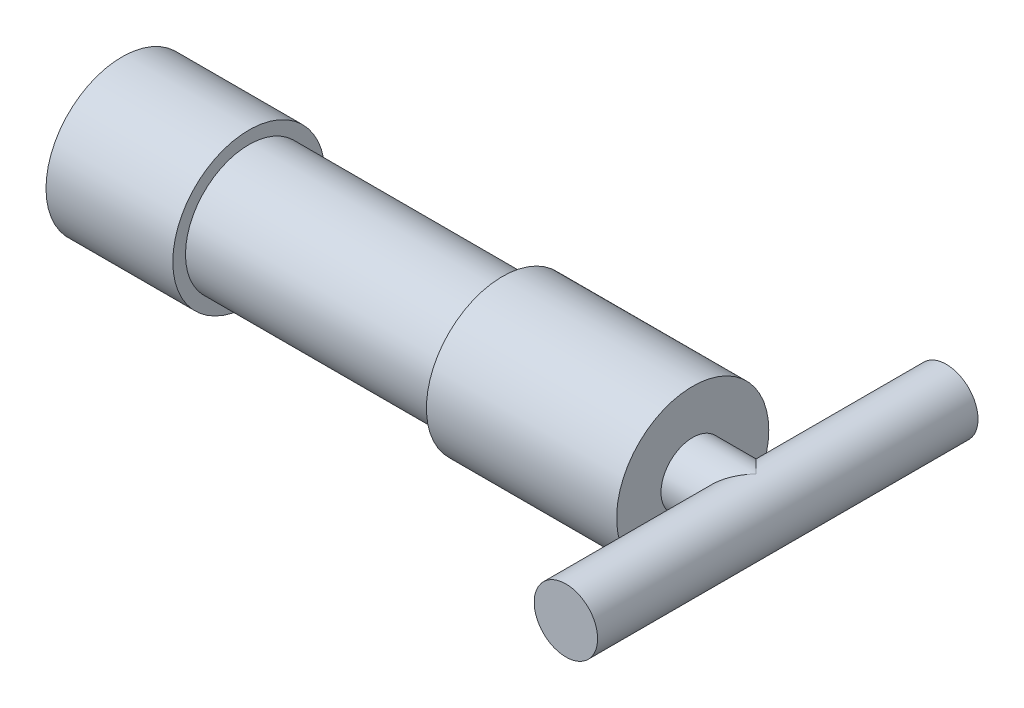
from build123d import *

# Parameters (mm, degrees)
SKETCH1_R                = 5
BOSS_EXTRUDE2_DEPTH      = 35
SKETCH3_R                = 2.5
BOSS_EXTRUDE3_DEPTH      = 5
SKETCH4_R                = 6
BOSS_EXTRUDE4_DEPTH      = 15
BOSS_EXTRUDE5_DEPTH      = 15
BOSS_EXTRUDE5_DEPTH_BACK = 15
SKETCH6_R                = 2.5
SKETCH7_R                = 6
BOSS_EXTRUDE6_DEPTH      = 10


with BuildPart() as part:
    # Sketch1 → Boss-Extrude2 (new body)
    with BuildSketch(Plane(origin=(0, 0, 0), x_dir=(0, 0, -1), z_dir=(1, 0, 0))):
        Circle(SKETCH1_R)
    extrude(amount=BOSS_EXTRUDE2_DEPTH)

    # Sketch3 → Boss-Extrude3 (add)
    with BuildSketch(Plane(origin=(35, 0, 0), x_dir=(0, 0, -1), z_dir=(1, 0, 0))):
        Circle(SKETCH3_R)
    extrude(amount=BOSS_EXTRUDE3_DEPTH)

    # Sketch4 → Boss-Extrude4 (add)
    with BuildSketch(Plane(origin=(35, 0, 0), x_dir=(0, 0, -1), z_dir=(1, 0, 0))):
        Circle(SKETCH4_R)
    extrude(amount=-BOSS_EXTRUDE4_DEPTH)

    # Sketch6 → Boss-Extrude5 (add, two sides: drawn at the far end of the back side and taken through both)
    with BuildSketch(Plane.XY.offset(-BOSS_EXTRUDE5_DEPTH_BACK)):
        with Locations((40, 0)):
            Circle(SKETCH6_R)
    extrude(amount=BOSS_EXTRUDE5_DEPTH + BOSS_EXTRUDE5_DEPTH_BACK)

    # Sketch7 → Boss-Extrude6 (add)
    with BuildSketch(Plane.ZY):
        Circle(SKETCH7_R)
    extrude(amount=BOSS_EXTRUDE6_DEPTH)


solid = part.part
